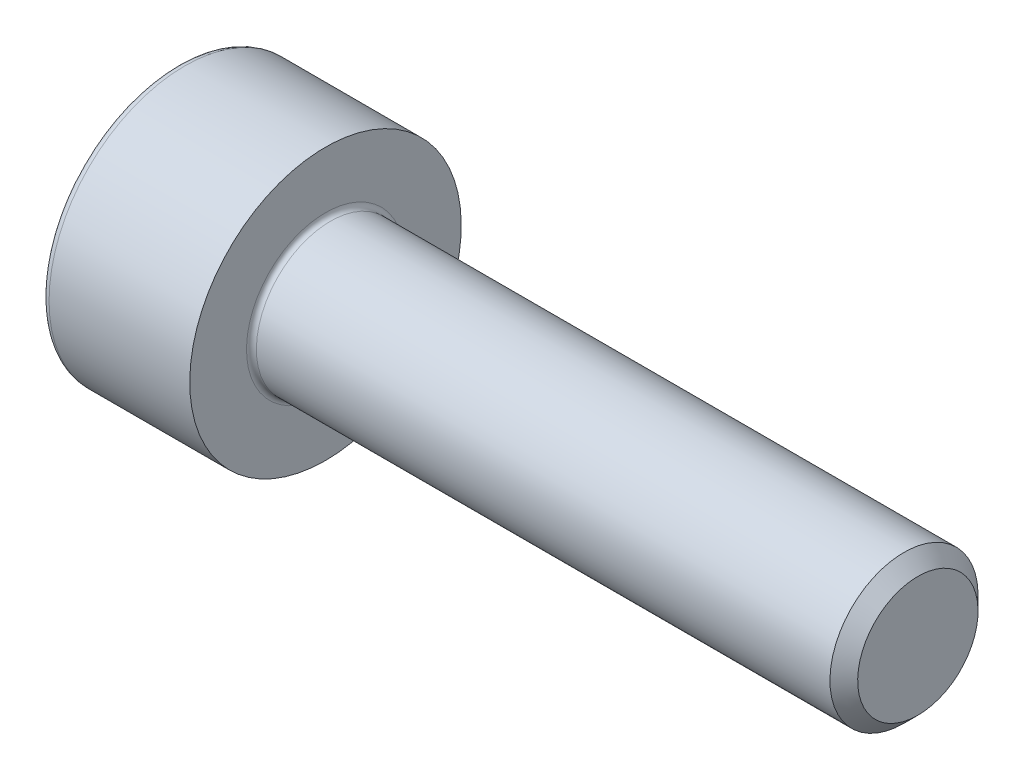
from build123d import *

# Parameters (mm, degrees)
CUT_EXTRUDE1_DEPTH = 1.3
FILLET1_R          = 0.15
CHAMFER1_SIZE      = 0.281
FILLET2_R          = 0.1


with BuildPart() as part:
    # Sketch1 → Revolve1 (revolve)
    with BuildSketch(Plane.XY):
        Polygon((-3, 0), (-3, 2.75), (0, 2.75), (0, 1.5), (12, 1.5), (12, 0), align=None)
    revolve(axis=Axis((0, 0, 0), (1, 0, 0)))

    # Sketch2 → Cut-Extrude1 (cut)
    with BuildSketch(Plane.ZY.offset(3)):
        Polygon((0, 1.478016689), (-1.28, 0.739008345), (-1.28, -0.739008345), (0, -1.478016689), (1.28, -0.739008345), (1.28, 0.739008345), align=None)
    extrude(amount=-CUT_EXTRUDE1_DEPTH, mode=Mode.SUBTRACT)

    # Fillet1
    fillet1_edges = [part.edges().sort_by_distance(p)[0] for p in [
        (-3, -2.75, 0),
    ]]
    fillet(fillet1_edges, radius=FILLET1_R)

    # Chamfer1
    chamfer1_edges = [part.edges().sort_by_distance(p)[0] for p in [
        (12, -1.5, 0),
    ]]
    chamfer(chamfer1_edges, length=CHAMFER1_SIZE)

    # Fillet2
    fillet2_edges = [part.edges().sort_by_distance(p)[0] for p in [
        (0, -1.5, 0),
    ]]
    fillet(fillet2_edges, radius=FILLET2_R)


solid = part.part
